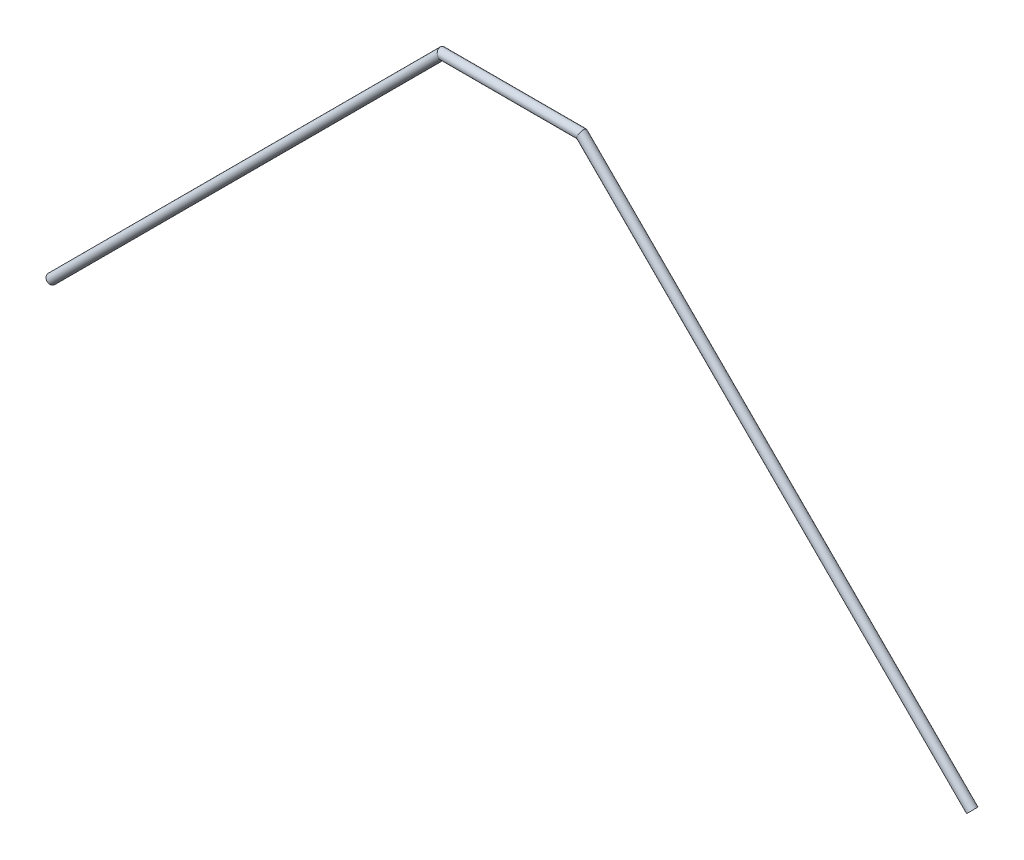
from build123d import *

# Parameters (mm, degrees)
SKETCH2_R = 25.4


with BuildPart() as part:
    # Sweep1: sweep along a path in Sketch1
    with BuildLine(Plane.XY) as sweep1_path:
        Line((-2514.6, -2133.6), (-381, 0))
        Line((-381, 0), (381, 0))
        Line((381, 0), (2514.6, -2133.6))
    # Sketch2 → Sweep1 (sweep)
    with BuildSketch(Plane(origin=(0, 0, 0), x_dir=(0, 0, -1), z_dir=(1, 0, 0))):
        Circle(SKETCH2_R)
    sweep(path=sweep1_path.line, transition=Transition.RIGHT)


solid = part.part
